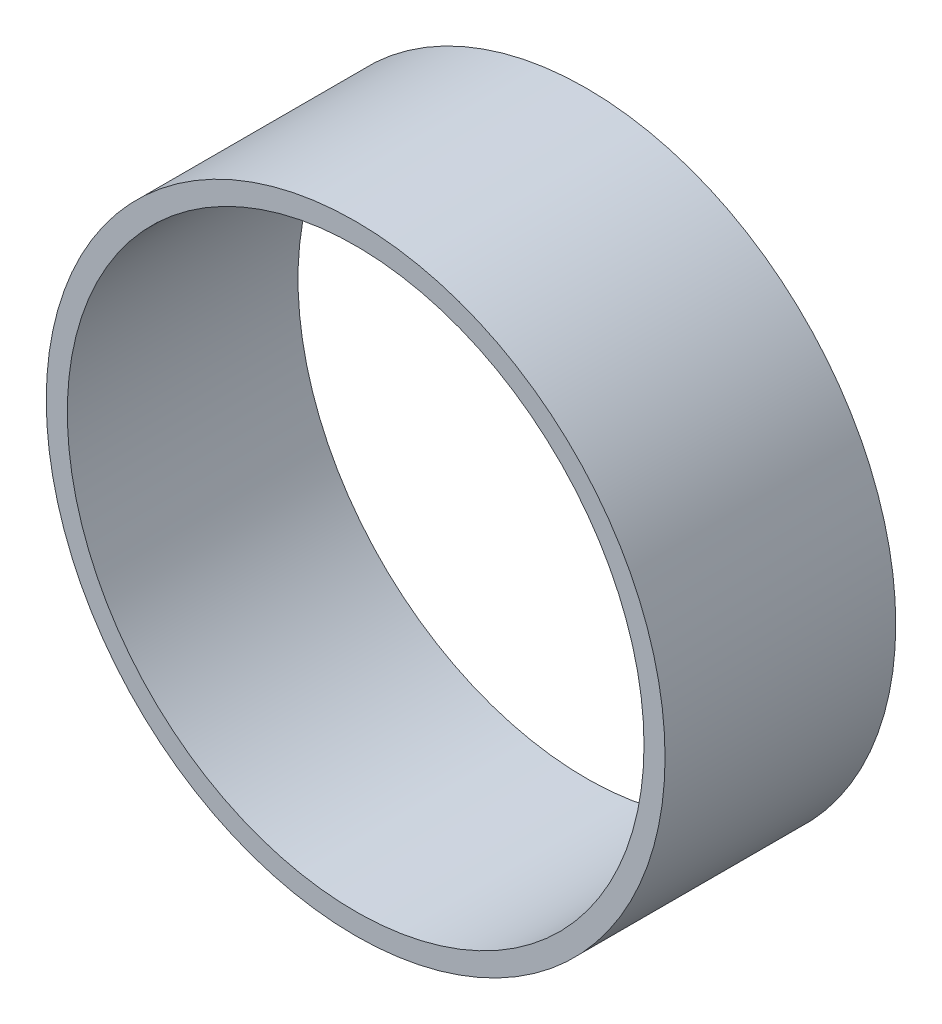
from build123d import *

# Parameters (mm, degrees)
SKETCH1_R           = 136.271
SKETCH1_R_2         = 127
BOSS_EXTRUDE1_DEPTH = 101.6


with BuildPart() as part:
    # Sketch1 → Boss-Extrude1 (new body)
    with BuildSketch(Plane.XY):
        Circle(SKETCH1_R)
        Circle(SKETCH1_R_2, mode=Mode.SUBTRACT)
    extrude(amount=BOSS_EXTRUDE1_DEPTH)


solid = part.part
